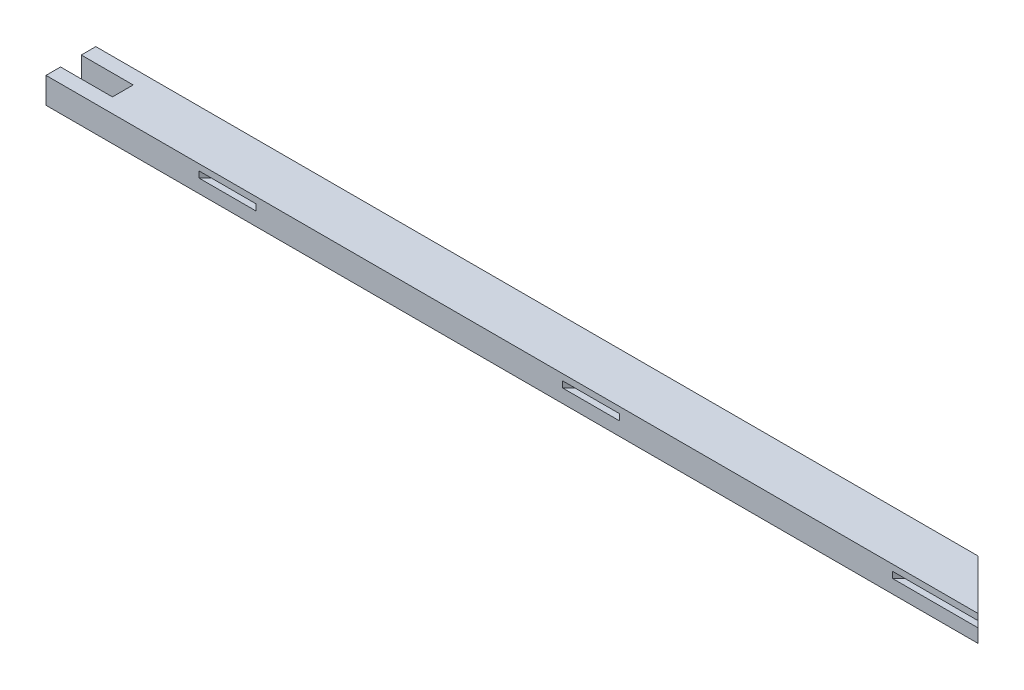
from build123d import *

# Parameters (mm, degrees)
EXTRUDE_1_DEPTH        = 25
CUT_EXTRUDE_START      = -6
CUT_EXTRUDE_2_DEPTH    = 6
PATTERN_LINEAR_1_COUNT = 2
PATTERN_LINEAR_1_PITCH = 350
MIRROR_START           = -6
MIRROR_1_COPY_1_DEPTH  = 6
CUT_EXTRUDE_3_DEPTH    = 6


with BuildPart() as part:
    # 草图1 → 凸台-拉伸1 (new body)
    with BuildSketch(Plane(origin=(0, 0, 0), x_dir=(1, 0, 0), z_dir=(0, 1, 0))):
        Polygon((0, 0), (0, -14), (50, -14), (50, -34), (0, -34), (0, -48), (898, -48), (850, 0), align=None)
    extrude(amount=EXTRUDE_1_DEPTH)

    # 草图5 → 切除-拉伸2 (cut)
    with BuildSketch(Plane(origin=(0, 25, 0), x_dir=(1, 0, 0), z_dir=(0, 1, 0)).offset(CUT_EXTRUDE_START)):
        Polygon((147.5, 0), (155, -7.5), (195, -7.5), (202.5, 0), align=None)
    cut_extrude_2 = extrude(amount=-CUT_EXTRUDE_2_DEPTH, mode=Mode.SUBTRACT)

    # 阵列(线性)1: 切除-拉伸2 ×2
    with Locations(*[(i * PATTERN_LINEAR_1_PITCH, 0, 0) for i in range(1, PATTERN_LINEAR_1_COUNT)]):
        add(cut_extrude_2, mode=Mode.SUBTRACT)

    # 镜向1: 切除-拉伸2 across plane
    add(cut_extrude_2.mirror(Plane.XY.offset(24)), mode=Mode.SUBTRACT)

    # 镜向1 copy 1 sketch → 镜向1 copy 1 (cut)
    with BuildSketch(Plane(origin=(350, 25, 48), x_dir=(1, 0, 0), z_dir=(0, 1, 0)).offset(MIRROR_START)):
        Polygon((147.5, 0), (155, 7.5), (195, 7.5), (202.5, 0), align=None)
    extrude(amount=-MIRROR_1_COPY_1_DEPTH, mode=Mode.SUBTRACT)

    # 草图6 → 切除-拉伸3 (cut)
    with BuildSketch(Plane(origin=(0, 25, 0), x_dir=(1, 0, 0), z_dir=(0, 1, 0)).offset(CUT_EXTRUDE_START)):
        Polygon((890.5, -40.5), (823, -40.5), (815.5, -48), (898, -48), align=None)
    cut_extrude_3 = extrude(amount=-CUT_EXTRUDE_3_DEPTH, mode=Mode.SUBTRACT)

    # 镜向2: 切除-拉伸3 across plane
    add(cut_extrude_3.mirror(Plane.XY.offset(24)), mode=Mode.SUBTRACT)


solid = part.part
